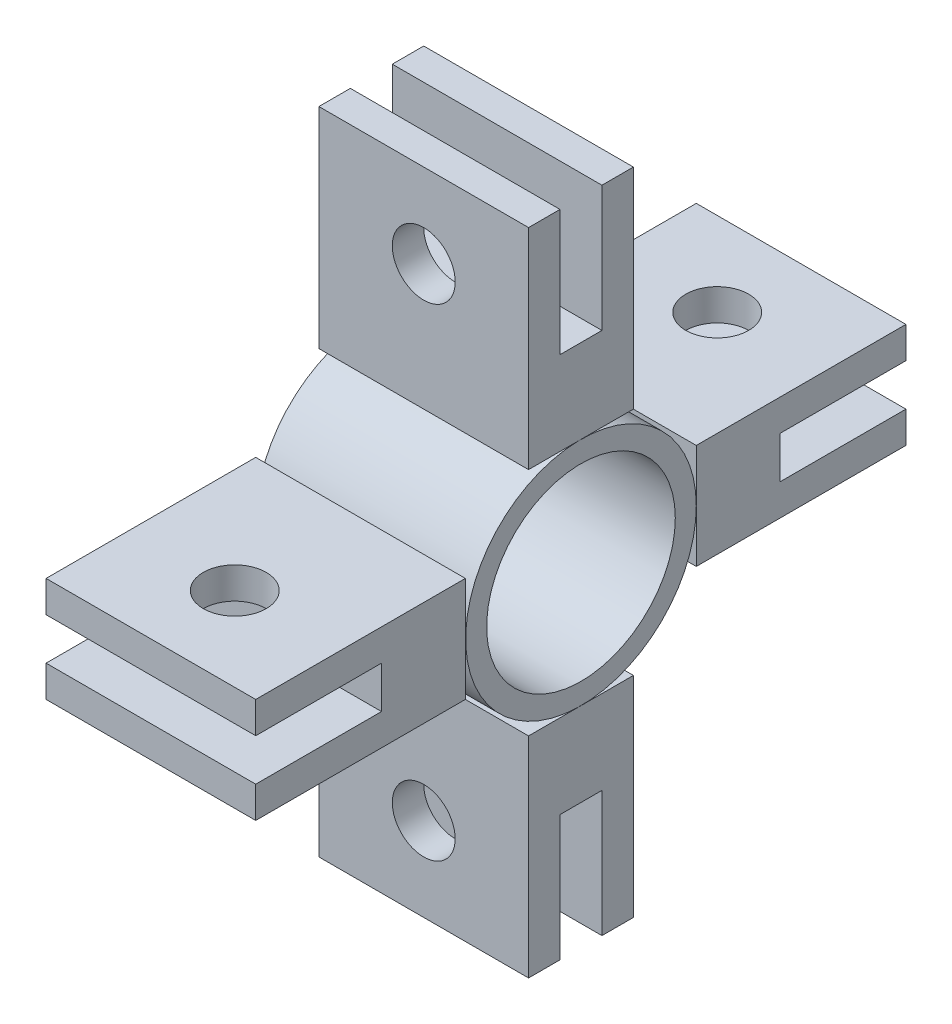
from build123d import *

# Parameters (mm, degrees)
SKETCH_1_R           = 55
EXTRUDE_1_DEPTH      = 100
SHELL_1_T            = -10
SKETCH_2_W           = 100
SKETCH_2_H           = 50
EXTRUDE_2_DEPTH      = 100
SKETCH_3_W           = 110
SKETCH_3_H           = 20
CUT_EXTRUDE_5_DEPTH  = 60
SKETCH_4_R           = 15
CUT_EXTRUDE_6_DEPTH  = 60
SKETCH_6_W           = 100
SKETCH_6_H           = 50
EXTRUDE_4_DEPTH      = 100
SKETCH_7_W           = 110
SKETCH_7_H           = 20
CUT_EXTRUDE_8_DEPTH  = 60
SKETCH_8_R           = 15
CUT_EXTRUDE_9_DEPTH  = 60
SKETCH_9_W           = 100
SKETCH_9_H           = 50
EXTRUDE_5_DEPTH      = 100
SKETCH_10_W          = 104.303969261
SKETCH_10_H          = 20
CUT_EXTRUDE_11_DEPTH = 60
SKETCH_11_R          = 15
CUT_EXTRUDE_12_DEPTH = 60
SKETCH_12_W          = 100
SKETCH_12_H          = 50
EXTRUDE_6_DEPTH      = 100
SKETCH_13_W          = 142.106913732
SKETCH_13_H          = 20
CUT_EXTRUDE_13_DEPTH = 60
SKETCH_14_R          = 15
CUT_EXTRUDE_14_DEPTH = 60


with BuildPart() as part:
    # 草图1 → 凸台-拉伸1 (new body)
    with BuildSketch(Plane(origin=(0, 0, 0), x_dir=(0, 0, -1), z_dir=(1, 0, 0))):
        Circle(SKETCH_1_R)
    extrude(amount=EXTRUDE_1_DEPTH)

    # 抽壳1
    shell_1_openings = [part.faces().sort_by_distance(p)[0] for p in [
        (100, 0, 0),
        (0, 0, 0),
    ]]
    offset(amount=SHELL_1_T, openings=shell_1_openings, kind=Kind.INTERSECTION)


with BuildPart() as body_2:
    # 草图2 → 凸台-拉伸2 (new body)
    with BuildSketch(Plane(origin=(0, 0, -55), x_dir=(-1, 0, 0), z_dir=(0, 0, -1))):
        with Locations((-50, 0)):
            Rectangle(SKETCH_2_W, SKETCH_2_H)
    extrude(amount=EXTRUDE_2_DEPTH)

    # 草图3 → 切除-拉伸5 (cut)
    with BuildSketch(Plane(origin=(0, 0, -155), x_dir=(-1, 0, 0), z_dir=(0, 0, -1))):
        with Locations((-50.103871793, 0)):
            Rectangle(SKETCH_3_W, SKETCH_3_H)
    extrude(amount=-CUT_EXTRUDE_5_DEPTH, mode=Mode.SUBTRACT)

    # 草图4 → 切除-拉伸6 (cut)
    with BuildSketch(Plane.XZ.offset(25)):
        with Locations(Location((50, -115, 0), (0, 0, 270))):
            Circle(SKETCH_4_R)
    extrude(amount=-CUT_EXTRUDE_6_DEPTH, mode=Mode.SUBTRACT)


with BuildPart() as body_3:
    # 草图6 → 凸台-拉伸4 (new body)
    with BuildSketch(Plane.XY.offset(55)):
        with Locations((49.859213062, 0)):
            Rectangle(SKETCH_6_W, SKETCH_6_H)
    extrude(amount=EXTRUDE_4_DEPTH)

    # 草图7 → 切除-拉伸8 (cut)
    with BuildSketch(Plane.XY.offset(155)):
        with Locations((45, 0)):
            Rectangle(SKETCH_7_W, SKETCH_7_H)
    extrude(amount=-CUT_EXTRUDE_8_DEPTH, mode=Mode.SUBTRACT)

    # 草图8 → 切除-拉伸9 (cut)
    with BuildSketch(Plane.XZ.offset(25)):
        with Locations(Location((49.859213062, 115, 0), (0, 0, 270))):
            Circle(SKETCH_8_R)
    extrude(amount=-CUT_EXTRUDE_9_DEPTH, mode=Mode.SUBTRACT)


with BuildPart() as body_4:
    # 草图9 → 凸台-拉伸5 (new body)
    with BuildSketch(Plane(origin=(0, -55, 0), x_dir=(-1, 0, 0), z_dir=(0, -1, 0))):
        with Locations((-50, 0)):
            Rectangle(SKETCH_9_W, SKETCH_9_H)
    extrude(amount=EXTRUDE_5_DEPTH)

    # 草图10 → 切除-拉伸11 (cut)
    with BuildSketch(Plane.XZ.offset(155)):
        with Locations((47.848015369, 0)):
            Rectangle(SKETCH_10_W, SKETCH_10_H)
    extrude(amount=-CUT_EXTRUDE_11_DEPTH, mode=Mode.SUBTRACT)

    # 草图11 → 切除-拉伸12 (cut)
    with BuildSketch(Plane.XY.offset(25)):
        with Locations((50, -115)):
            Circle(SKETCH_11_R)
    extrude(amount=-CUT_EXTRUDE_12_DEPTH, mode=Mode.SUBTRACT)


with BuildPart() as body_5:
    # 草图12 → 凸台-拉伸6 (new body)
    with BuildSketch(Plane(origin=(0, 55, 0), x_dir=(1, 0, 0), z_dir=(0, 1, 0))):
        with Locations((50, 0)):
            Rectangle(SKETCH_12_W, SKETCH_12_H)
    extrude(amount=EXTRUDE_6_DEPTH)

    # 草图13 → 切除-拉伸13 (cut)
    with BuildSketch(Plane(origin=(0, 155, 0), x_dir=(1, 0, 0), z_dir=(0, 1, 0))):
        with Locations((52.372018241, 0)):
            Rectangle(SKETCH_13_W, SKETCH_13_H)
    extrude(amount=-CUT_EXTRUDE_13_DEPTH, mode=Mode.SUBTRACT)

    # 草图14 → 切除-拉伸14 (cut)
    with BuildSketch(Plane.XY.offset(25)):
        with Locations((50, 115)):
            Circle(SKETCH_14_R)
    extrude(amount=-CUT_EXTRUDE_14_DEPTH, mode=Mode.SUBTRACT)


solid = Compound([part.part, body_2.part, body_3.part, body_4.part, body_5.part])
